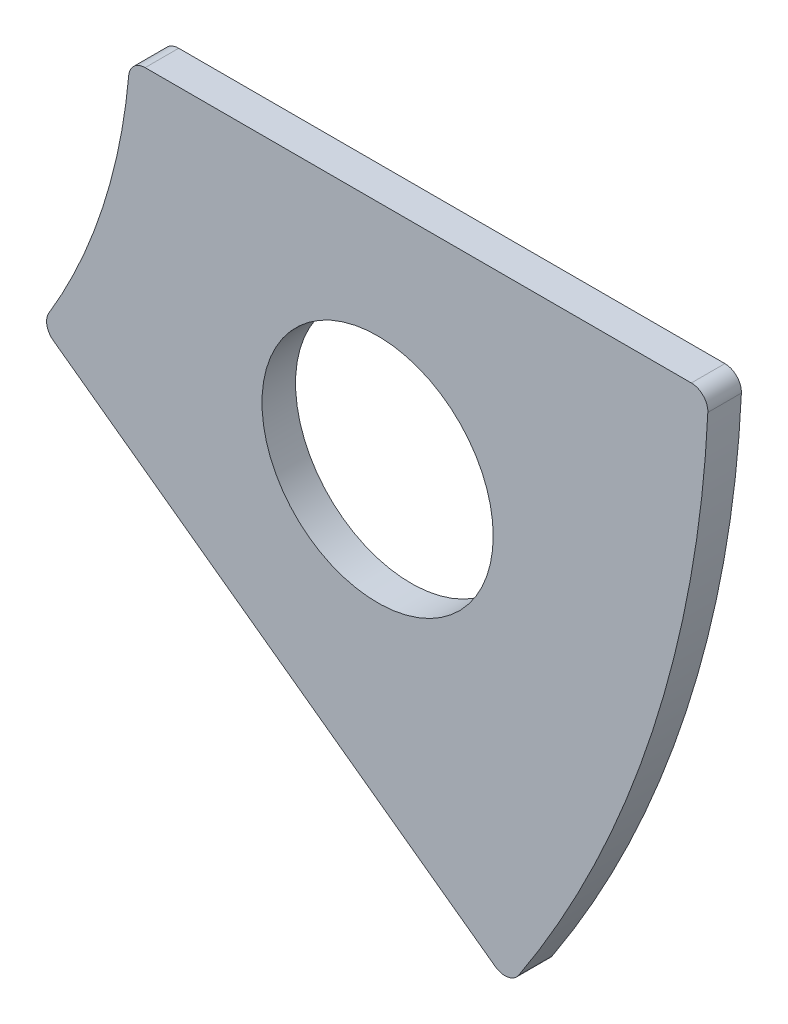
from build123d import *

# Parameters (mm, degrees)
BOSS_EXTRUDE1_DEPTH  = 1.016
M6_CLEARANCE_HOLE1_D = 7
FILLET2_R            = 0.5


with BuildPart() as part:
    # Sketch1 → Boss-Extrude1 (new body)
    with BuildSketch(Plane.XY):
        with BuildLine():
            Line((17.465394356, -1.1), (34.982710015, -1.1))
            ThreePointArc((34.982710015, -1.1), (33.28697807, -10.815594803), (28.948170689, -19.672402338))
            Line((28.948170689, -19.672402338), (14.776364625, -9.375982534))
            ThreePointArc((14.776364625, -9.375982534), (16.643489035, -5.407797402), (17.465394356, -1.1))
        make_face()
    extrude(amount=BOSS_EXTRUDE1_DEPTH)

    # M6 Clearance Hole1 (through all)
    with Locations(Plane.XY.offset(1.016)):
        with Locations((24.965233553, -8.111696102)):
            Hole(M6_CLEARANCE_HOLE1_D / 2)

    # Fillet2
    fillet2_edges = [part.edges().sort_by_distance(p)[0] for p in [
        (17.465394356, -1.1, 0.508),
        (34.982710015, -1.1, 0.508),
        (28.948170689, -19.672402338, 0.508),
        (14.776364625, -9.375982534, 0.508),
    ]]
    fillet(fillet2_edges, radius=FILLET2_R)


solid = part.part
